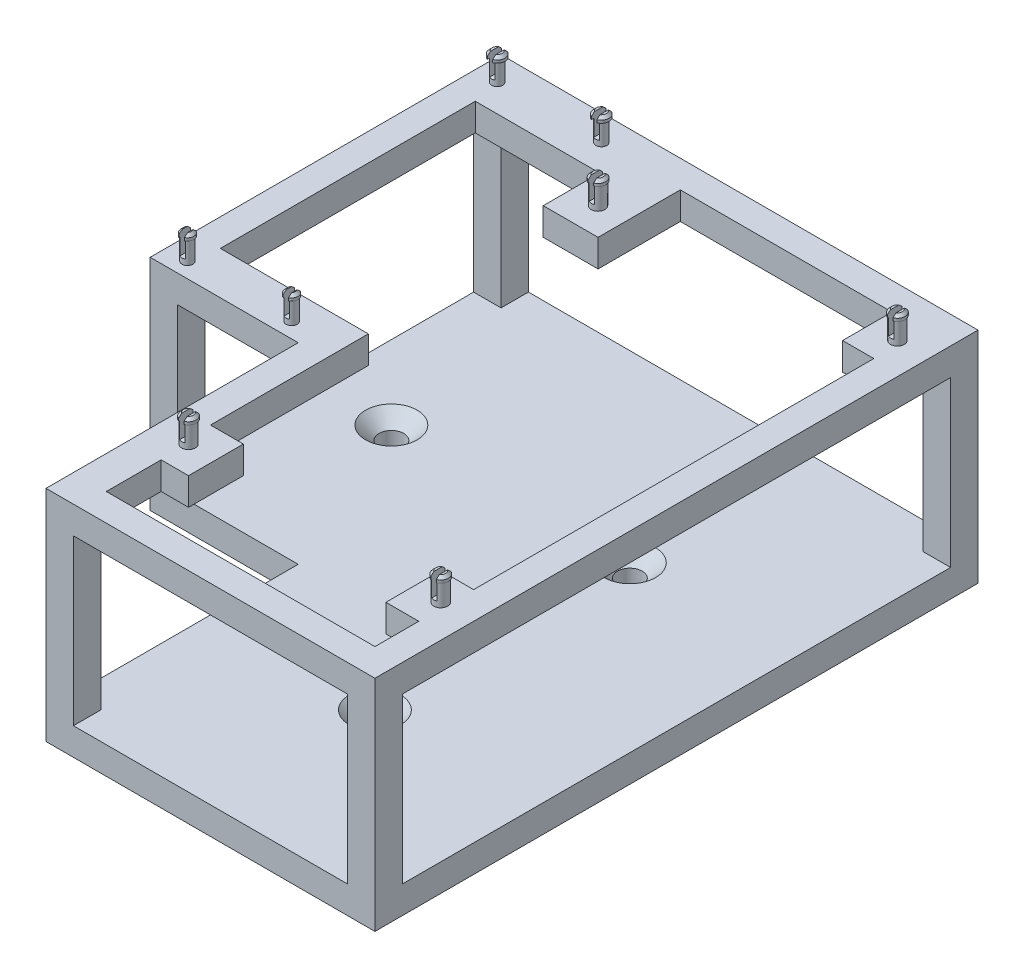
from build123d import *

# Parameters (mm, degrees)
BOSS_EXTRUDE1_DEPTH                             = 15
SKETCH2_W                                       = 60
SKETCH2_H                                       = 110
BOSS_EXTRUDE2_DEPTH                             = 5
SKETCH3_R                                       = 1.25
BOSS_EXTRUDE3_DEPTH                             = 4
SKETCH4_R                                       = 1.405
BOSS_EXTRUDE4_DEPTH                             = 1
CHAMFER1_SIZE                                   = 0.5
SKETCH5_W                                       = 1
SKETCH5_H                                       = 3.260897444
CUT_EXTRUDE1_DEPTH                              = 4
SKETCH7_R                                       = 1.25
BOSS_EXTRUDE5_DEPTH                             = 4
SKETCH8_R                                       = 1.405
BOSS_EXTRUDE6_DEPTH                             = 1
CHAMFER2_SIZE                                   = 0.5
SKETCH9_W                                       = 1
SKETCH9_H                                       = 4.099421272
SKETCH9_H_2                                     = 4.814063164
CUT_EXTRUDE2_DEPTH                              = 4
SKETCH10_R                                      = 1.25
BOSS_EXTRUDE7_DEPTH                             = 4
SKETCH11_R                                      = 1.405
BOSS_EXTRUDE8_DEPTH                             = 1
CHAMFER3_SIZE                                   = 0.5
SKETCH12_W                                      = 1
SKETCH12_H                                      = 3.78691003
CUT_EXTRUDE3_DEPTH                              = 4
SKETCH14_W                                      = 27
SKETCH14_H                                      = 64
BOSS_EXTRUDE9_DEPTH                             = 5
CUT_EXTRUDE6_DEPTH                              = 85.858706094
SKETCH15_R                                      = 1
BOSS_EXTRUDE10_DEPTH                            = 4
SKETCH16_R                                      = 1.175
BOSS_EXTRUDE11_DEPTH                            = 1
CHAMFER4_SIZE                                   = 0.5
SKETCH17_W                                      = 1
SKETCH17_H                                      = 3.189279986
CUT_EXTRUDE7_DEPTH                              = 4
SKETCH20_R                                      = 1
BOSS_EXTRUDE12_DEPTH                            = 4
SKETCH21_R                                      = 1.405
BOSS_EXTRUDE13_DEPTH                            = 1
CHAMFER5_SIZE                                   = 0.5
SKETCH23_W                                      = 1
SKETCH23_H                                      = 4.222684002
CUT_EXTRUDE8_DEPTH                              = 4
CUT_EXTRUDE9_DEPTH                              = 82.547532152
SKETCH26_W                                      = 5
SKETCH26_H                                      = 5
BOSS_EXTRUDE15_DEPTH                            = 30
BOSS_EXTRUDE16_DEPTH                            = 5
CSK_FOR_M4_FLAT_HEAD_MACHINE_SCREW2_D           = 4.5
CSK_FOR_M4_FLAT_HEAD_MACHINE_SCREW2_DEPTH       = 5
CSK_FOR_M4_FLAT_HEAD_MACHINE_SCREW2_CSINK_D     = 9.4
CSK_FOR_M4_FLAT_HEAD_MACHINE_SCREW2_CSINK_ANGLE = 90
CSK_FOR_M4_FLAT_HEAD_MACHINE_SCREW2_TIP         = 1.351936393


with BuildPart() as part:
    # Sketch1 → Boss-Extrude1 (new, symmetric)
    with BuildSketch(Plane.XY):
        Polygon((0, 0), (10, 0), (55, 2.358350068), (54.738678842, 7.344654806), (10, 5), (5, 5), (5, 24), (60, 24), (60, 29), (0, 29), align=None)
    extrude(amount=BOSS_EXTRUDE1_DEPTH, both=True)

    # Sketch2 → Boss-Extrude2 (add)
    with BuildSketch(Plane(origin=(0, 29, 0), x_dir=(1, 0, 0), z_dir=(0, 1, 0))):
        with Locations((30, 0)):
            Rectangle(SKETCH2_W, SKETCH2_H)
    extrude(amount=-BOSS_EXTRUDE2_DEPTH)

    # Sketch3 → Boss-Extrude3 (add)
    with BuildSketch(Plane(origin=(0, 29, 0), x_dir=(1, 0, 0), z_dir=(0, 1, 0))):
        with Locations(Location((54, -37, 0), (0, 0, 90))):
            Circle(SKETCH3_R)
    extrude(amount=BOSS_EXTRUDE3_DEPTH)

    # Sketch4 → Boss-Extrude4 (add)
    with BuildSketch(Plane(origin=(0, 33, 0), x_dir=(1, 0, 0), z_dir=(0, 1, 0))):
        with Locations(Location((54, -37, 0), (0, 0, 270))):
            Circle(SKETCH4_R)
    extrude(amount=BOSS_EXTRUDE4_DEPTH)

    # Chamfer1
    chamfer1_edges = [part.edges().sort_by_distance(p)[0] for p in [
        (54, 34, 35.595),
    ]]
    chamfer(chamfer1_edges, length=CHAMFER1_SIZE)

    # Sketch5 → Cut-Extrude1 (cut)
    with BuildSketch(Plane(origin=(0, 34, 0), x_dir=(1, 0, 0), z_dir=(0, 1, 0))):
        with Locations((54, -37)):
            Rectangle(SKETCH5_W, SKETCH5_H)
    extrude(amount=-CUT_EXTRUDE1_DEPTH, mode=Mode.SUBTRACT)

    # Sketch7 → Boss-Extrude5 (add)
    with BuildSketch(Plane(origin=(0, 29, 0), x_dir=(1, 0, 0), z_dir=(0, 1, 0))):
        with Locations(Location((54.3, 46, 0), (0, 0, 90))):
            Circle(SKETCH7_R)
        with Locations(Location((5.7, 40, 0), (0, 0, 90))):
            Circle(SKETCH7_R)
    extrude(amount=BOSS_EXTRUDE5_DEPTH)

    # Sketch8 → Boss-Extrude6 (add)
    with BuildSketch(Plane(origin=(0, 33, 0), x_dir=(1, 0, 0), z_dir=(0, 1, 0))):
        with Locations(Location((5.7, 40, 0), (0, 0, 270))):
            Circle(SKETCH8_R)
        with Locations(Location((54.3, 46, 0), (0, 0, 270))):
            Circle(SKETCH8_R)
    extrude(amount=BOSS_EXTRUDE6_DEPTH)

    # Chamfer2
    chamfer2_edges = [part.edges().sort_by_distance(p)[0] for p in [
        (5.7, 34, -41.405),
        (54.3, 34, -47.405),
    ]]
    chamfer(chamfer2_edges, length=CHAMFER2_SIZE)

    # Sketch9 → Cut-Extrude2 (cut)
    with BuildSketch(Plane(origin=(0, 34, 0), x_dir=(1, 0, 0), z_dir=(0, 1, 0))):
        with Locations((5.7, 40)):
            Rectangle(SKETCH9_W, SKETCH9_H)
        with Locations((54.3, 46)):
            Rectangle(SKETCH9_W, SKETCH9_H_2)
    extrude(amount=-CUT_EXTRUDE2_DEPTH, mode=Mode.SUBTRACT)

    # Sketch10 → Boss-Extrude7 (add)
    with BuildSketch(Plane(origin=(0, 29, 0), x_dir=(1, 0, 0), z_dir=(0, 1, 0))):
        with Locations(Location((6, -35, 0), (0, 0, 90))):
            Circle(SKETCH10_R)
    extrude(amount=BOSS_EXTRUDE7_DEPTH)

    # Sketch11 → Boss-Extrude8 (add)
    with BuildSketch(Plane(origin=(0, 33, 0), x_dir=(1, 0, 0), z_dir=(0, 1, 0))):
        with Locations(Location((6, -35, 0), (0, 0, 270))):
            Circle(SKETCH11_R)
    extrude(amount=BOSS_EXTRUDE8_DEPTH)

    # Chamfer3
    chamfer3_edges = [part.edges().sort_by_distance(p)[0] for p in [
        (6, 34, 33.595),
    ]]
    chamfer(chamfer3_edges, length=CHAMFER3_SIZE)

    # Sketch12 → Cut-Extrude3 (cut)
    with BuildSketch(Plane(origin=(0, 34, 0), x_dir=(1, 0, 0), z_dir=(0, 1, 0))):
        with Locations((6, -35)):
            Rectangle(SKETCH12_W, SKETCH12_H)
    extrude(amount=-CUT_EXTRUDE3_DEPTH, mode=Mode.SUBTRACT)

    # Sketch14 → Boss-Extrude9 (add)
    with BuildSketch(Plane(origin=(0, 29, 0), x_dir=(1, 0, 0), z_dir=(0, 1, 0))):
        with Locations((-13.5, 23)):
            Rectangle(SKETCH14_W, SKETCH14_H)
    extrude(amount=-BOSS_EXTRUDE9_DEPTH)

    # Sketch13 → Cut-Extrude6 (cut, through all)
    with BuildSketch(Plane.XZ.offset(-24)):
        Polygon((0, 15), (0, -15), (0, -55), (60, -55), (60, 55), (0, 55), align=None)
    extrude(amount=CUT_EXTRUDE6_DEPTH, mode=Mode.SUBTRACT)

    # Sketch15 → Boss-Extrude10 (add)
    with BuildSketch(Plane(origin=(0, 29, 0), x_dir=(1, 0, 0), z_dir=(0, 1, 0))):
        with Locations(Location((-23, -6.2, 0), (0, 0, 90))):
            Circle(SKETCH15_R)
        with Locations(Location((-4, -6.2, 0), (0, 0, 90))):
            Circle(SKETCH15_R)
    extrude(amount=BOSS_EXTRUDE10_DEPTH)

    # Sketch16 → Boss-Extrude11 (add)
    with BuildSketch(Plane(origin=(0, 33, 0), x_dir=(1, 0, 0), z_dir=(0, 1, 0))):
        with Locations(Location((-23, -6.2, 0), (0, 0, 270))):
            Circle(SKETCH16_R)
        with Locations(Location((-4, -6.2, 0), (0, 0, 270))):
            Circle(SKETCH16_R)
    extrude(amount=BOSS_EXTRUDE11_DEPTH)

    # Chamfer4
    chamfer4_edges = [part.edges().sort_by_distance(p)[0] for p in [
        (-23, 34, 5.025),
        (-4, 34, 5.025),
    ]]
    chamfer(chamfer4_edges, length=CHAMFER4_SIZE)

    # Sketch17 → Cut-Extrude7 (cut)
    with BuildSketch(Plane(origin=(0, 34, 0), x_dir=(1, 0, 0), z_dir=(0, 1, 0))):
        with Locations((-23, -6.2)):
            Rectangle(SKETCH17_W, SKETCH17_H)
        with Locations((-4, -6.2)):
            Rectangle(SKETCH17_W, SKETCH17_H)
    extrude(amount=-CUT_EXTRUDE7_DEPTH, mode=Mode.SUBTRACT)

    # Sketch20 → Boss-Extrude12 (add)
    with BuildSketch(Plane(origin=(0, 29, 0), x_dir=(1, 0, 0), z_dir=(0, 1, 0))):
        with Locations(Location((-23, 50.3, 0), (0, 0, 90))):
            Circle(SKETCH20_R)
        with Locations(Location((-4, 50.3, 0), (0, 0, 90))):
            Circle(SKETCH20_R)
    extrude(amount=BOSS_EXTRUDE12_DEPTH)

    # Sketch21 → Boss-Extrude13 (add)
    with BuildSketch(Plane(origin=(0, 33, 0), x_dir=(1, 0, 0), z_dir=(0, 1, 0))):
        with Locations(Location((-23, 50.3, 0), (0, 0, 270))):
            Circle(SKETCH21_R)
        with Locations(Location((-4, 50.3, 0), (0, 0, 270))):
            Circle(SKETCH21_R)
    extrude(amount=BOSS_EXTRUDE13_DEPTH)

    # Chamfer5
    chamfer5_edges = [part.edges().sort_by_distance(p)[0] for p in [
        (-23, 34, -51.705),
        (-4, 34, -51.705),
    ]]
    chamfer(chamfer5_edges, length=CHAMFER5_SIZE)

    # Sketch23 → Cut-Extrude8 (cut)
    with BuildSketch(Plane(origin=(0, 34, 0), x_dir=(1, 0, 0), z_dir=(0, 1, 0))):
        with Locations((-23, 50.3)):
            Rectangle(SKETCH23_W, SKETCH23_H)
        with Locations((-4, 50.3)):
            Rectangle(SKETCH23_W, SKETCH23_H)
    extrude(amount=-CUT_EXTRUDE8_DEPTH, mode=Mode.SUBTRACT)

    # Sketch18 → Cut-Extrude9 (cut, through all)
    with BuildSketch(Plane(origin=(0, 29, 0), x_dir=(1, 0, 0), z_dir=(0, 1, 0))):
        Polygon((-22, 45.3), (0.7, 45.3), (0.7, 35), (10.7, 35), (10.7, 50), (49.3, 50), (49.3, 41), (55, 41), (55, -32), (49, -32), (49, -42), (55, -42), (55, -50), (6, -50), (6, -40), (11, -40), (11, -30), (5, -30), (5, -1.2), (-22, -1.2), align=None)
    extrude(amount=-CUT_EXTRUDE9_DEPTH, mode=Mode.SUBTRACT)

    # Sketch26 → Boss-Extrude15 (add)
    with BuildSketch(Plane.XZ.offset(-24)):
        with Locations((2.5, 52.5)):
            Rectangle(SKETCH26_W, SKETCH26_H)
        with Locations((57.5, 52.5)):
            Rectangle(SKETCH26_W, SKETCH26_H)
        with Locations((57.5, -52.5)):
            Rectangle(SKETCH26_W, SKETCH26_H)
        with Locations((-24.5, -52.5)):
            Rectangle(SKETCH26_W, SKETCH26_H)
        with Locations((-24.5, 6.5)):
            Rectangle(SKETCH26_W, SKETCH26_H)
    extrude(amount=BOSS_EXTRUDE15_DEPTH)

    # Sketch27 → Boss-Extrude16 (add)
    with BuildSketch(Plane.XZ.offset(6)):
        Polygon((0, 55), (60, 55), (60, -55), (0, -55), (-27, -55), (-27, 9), (0, 9), align=None)
    extrude(amount=BOSS_EXTRUDE16_DEPTH)

    # CSK for M4 Flat Head Machine Screw2
    with Locations(Plane(origin=(0, -6, 0), x_dir=(1, 0, 0), z_dir=(0, 1, 0))):
        with Locations((-13.5, 21.5), (30, 21.5), (30, -25)):
            CounterSinkHole(CSK_FOR_M4_FLAT_HEAD_MACHINE_SCREW2_D / 2, CSK_FOR_M4_FLAT_HEAD_MACHINE_SCREW2_CSINK_D / 2, depth=CSK_FOR_M4_FLAT_HEAD_MACHINE_SCREW2_DEPTH, counter_sink_angle=CSK_FOR_M4_FLAT_HEAD_MACHINE_SCREW2_CSINK_ANGLE)
            with Locations((0, 0, -(CSK_FOR_M4_FLAT_HEAD_MACHINE_SCREW2_DEPTH + CSK_FOR_M4_FLAT_HEAD_MACHINE_SCREW2_TIP / 2))):  # 118° drill point
                Cone(0, CSK_FOR_M4_FLAT_HEAD_MACHINE_SCREW2_D / 2, CSK_FOR_M4_FLAT_HEAD_MACHINE_SCREW2_TIP, mode=Mode.SUBTRACT)


solid = part.part
